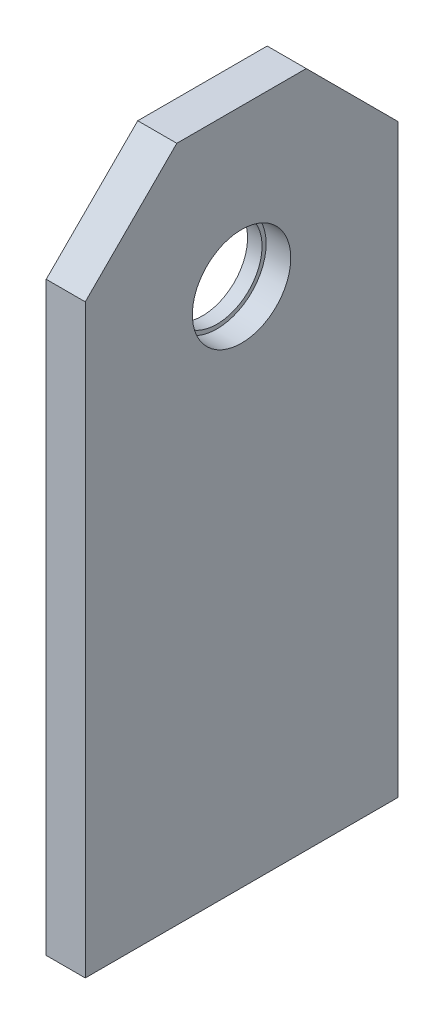
from build123d import *

# Parameters (mm, degrees)
SKETCH1_R           = 11
BOSS_EXTRUDE1_DEPTH = 4.7625
SKETCH2_R           = 12
CUT_EXTRUDE1_DEPTH  = 6
SKETCH3_R           = 2.778125
CUT_EXTRUDE2_DEPTH  = 25.4


with BuildPart() as part:
    # Sketch1 → Boss-Extrude1 (new, symmetric)
    with BuildSketch(Plane(origin=(0, 0, 0), x_dir=(0, 0, -1), z_dir=(1, 0, 0))):
        Polygon((-38.1, -127), (-38.1, 15.781536726), (-15.781536726, 38.1), (15.781536726, 38.1), (38.1, 15.781536726), (38.1, -127), align=None)
        with Locations(Location((0, 0, 0), (0, 0, 180))):
            Circle(SKETCH1_R, mode=Mode.SUBTRACT)
    extrude(amount=BOSS_EXTRUDE1_DEPTH, both=True)

    # Sketch2 → Cut-Extrude1 (cut)
    with BuildSketch(Plane(origin=(4.7625, 0, 0), x_dir=(0, 0, -1), z_dir=(1, 0, 0))):
        Circle(SKETCH2_R)
    extrude(amount=-CUT_EXTRUDE1_DEPTH, mode=Mode.SUBTRACT)

    # Sketch3 → Cut-Extrude2 (cut)
    with BuildSketch(Plane.XZ.offset(127)):
        with Locations(Location((0, 30.1625, 0), (0, 0, 270))):
            Circle(SKETCH3_R)
        with Locations(Location((0, -30.1625, 0), (0, 0, 270))):
            Circle(SKETCH3_R)
    extrude(amount=-CUT_EXTRUDE2_DEPTH, mode=Mode.SUBTRACT)


solid = part.part
